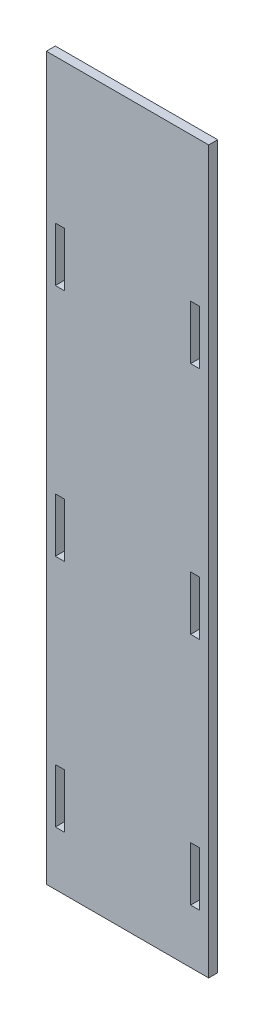
from build123d import *

# Parameters (mm, degrees)
SKETCH1_W           = 57.15
SKETCH1_H           = 254
BOSS_EXTRUDE1_DEPTH = 3.175
SKETCH3_W           = 3.175
SKETCH3_H           = 19.05
CUT_EXTRUDE1_DEPTH  = 261.369359036


with BuildPart() as part:
    # Sketch1 → Boss-Extrude1 (new body)
    with BuildSketch(Plane.XY):
        with Locations((28.575, 127)):
            Rectangle(SKETCH1_W, SKETCH1_H)
    extrude(amount=BOSS_EXTRUDE1_DEPTH)

    # Sketch3 → Cut-Extrude1 (cut, through all)
    with BuildSketch(Plane.XY.offset(3.175)):
        with Locations((4.7625, 193.675)):
            Rectangle(SKETCH3_W, SKETCH3_H)
        with Locations((4.7625, 111.125)):
            Rectangle(SKETCH3_W, SKETCH3_H)
        with Locations((4.7625, 28.575)):
            Rectangle(SKETCH3_W, SKETCH3_H)
        with Locations((52.3875, 193.675)):
            Rectangle(SKETCH3_W, SKETCH3_H)
        with Locations((52.3875, 111.125)):
            Rectangle(SKETCH3_W, SKETCH3_H)
        with Locations((52.3875, 28.575)):
            Rectangle(SKETCH3_W, SKETCH3_H)
    extrude(amount=-CUT_EXTRUDE1_DEPTH, mode=Mode.SUBTRACT)


solid = part.part
